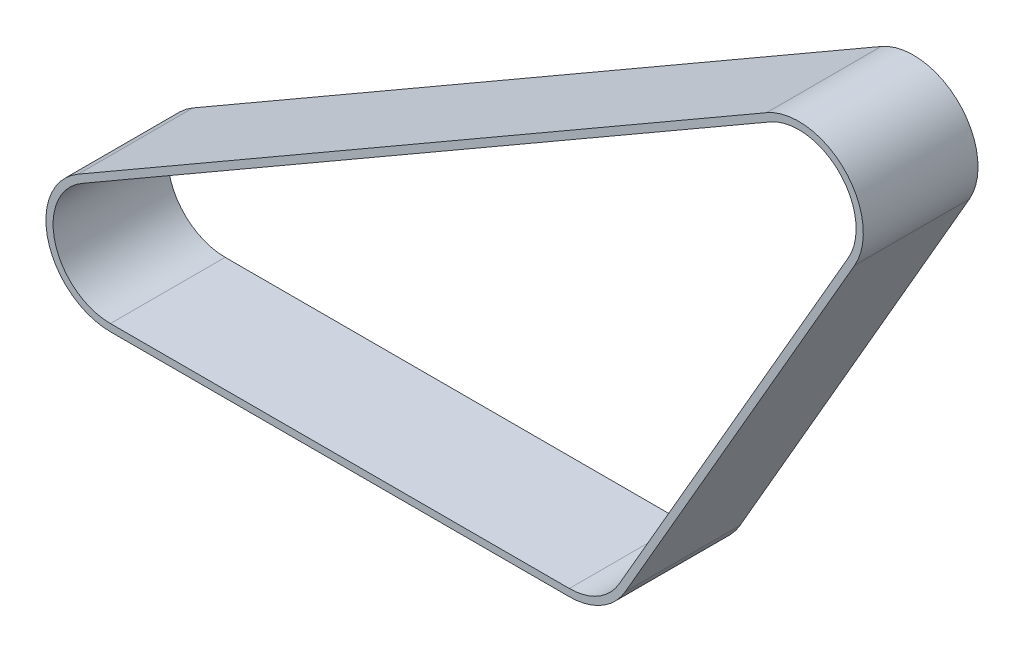
from build123d import *

# Parameters (mm, degrees)
BOSS_EXTRUDE1_DEPTH = 25.4


with BuildPart() as part:
    # Sketch1 → Boss-Extrude1 (new body)
    with BuildSketch(Plane.XY):
        with BuildLine():
            Line((43.65625, 100.361518981), (-108.74375, 12.373337957))
            ThreePointArc((-108.74375, 12.373337957), (-115.400665243, -3.697877107), (-101.6, -14.2875))
            Line((-101.6, -14.2875), (0, -14.2875))
            ThreePointArc((0, -14.2875), (7.14375, -12.373337957), (12.373337957, -7.14375))
            Line((12.373337957, -7.14375), (63.173337957, 80.844431024))
            ThreePointArc((63.173337957, 80.844431024), (60.902788136, 98.090969161), (43.65625, 100.361518981))
        make_face()
        with BuildLine():
            Line((-101.6, -12.7), (0, -12.7))
            ThreePointArc((0, -12.7), (6.35, -10.998522628), (10.998522628, -6.35))
            Line((10.998522628, -6.35), (61.798522628, 81.638181024))
            ThreePointArc((61.798522628, 81.638181024), (59.780256121, 96.968437146), (44.45, 98.986703653))
            Line((44.45, 98.986703653), (-107.95, 10.998522628))
            ThreePointArc((-107.95, 10.998522628), (-113.867257994, -3.287001873), (-101.6, -12.7))
        make_face(mode=Mode.SUBTRACT)
    extrude(amount=BOSS_EXTRUDE1_DEPTH)


solid = part.part
